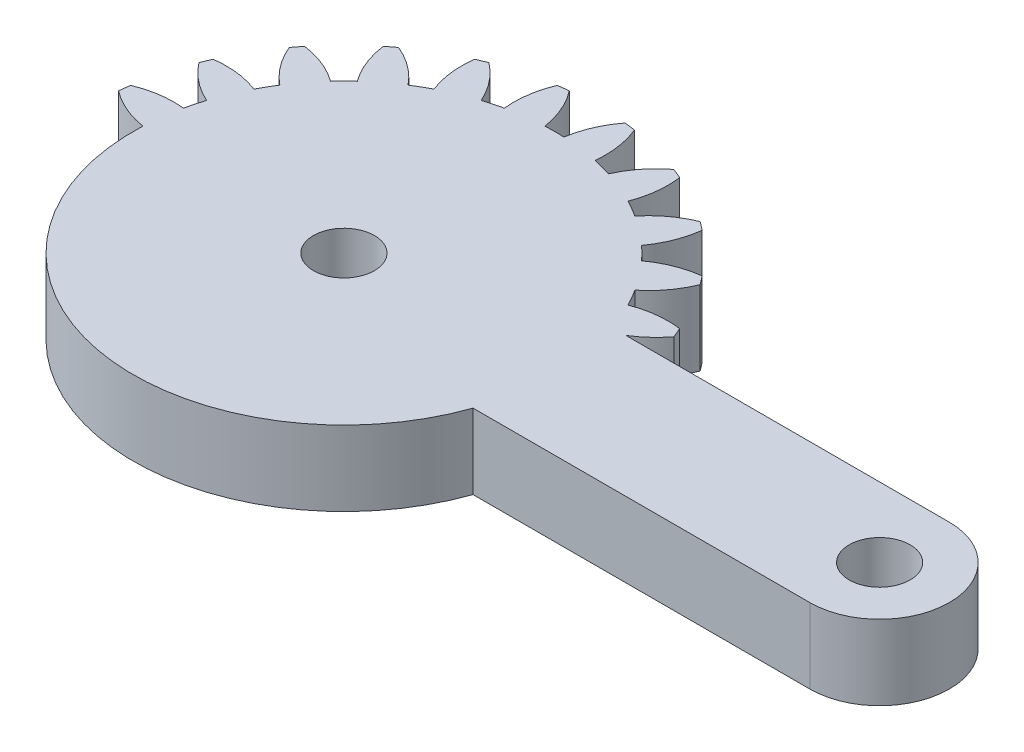
from build123d import *
from build123d.topology import SkipClean

# Parameters (mm, degrees)
SKETCH1_R           = 1.75
BOSS_EXTRUDE1_DEPTH = 4.3
CUT_EXTRUDE1_START  = -10
CUT_EXTRUDE1_DEPTH  = 10


with BuildPart() as part:
    # Sketch1 → Boss-Extrude1 (new body)
    with BuildSketch(Plane(origin=(0, 0, 0), x_dir=(1, 0, 0), z_dir=(0, 1, 0))):
        with BuildLine():
            Line((20.643657446, 4), (2.081641936, 4))
            ThreePointArc((2.081641936, 4), (2.861028333, 4.588201733), (3.521749436, 5.30713988))
            ThreePointArc((3.521749436, 5.30713988), (3.405395609, 5.596745198), (3.282888305, 5.883801663))
            ThreePointArc((3.282888305, 5.883801663), (1.93527598, 5.894040025), (0.627094961, 5.57027124))
            ThreePointArc((0.627094961, 5.57027124), (0.366286148, 6.046375), (0.084372603, 6.510293938))
            ThreePointArc((0.084372603, 6.510293938), (1.018855105, 7.48132754), (1.683794586, 8.65351323))
            ThreePointArc((1.683794586, 8.65351323), (1.496450048, 8.903135899), (1.303821399, 9.148703928))
            ThreePointArc((1.303821399, 9.148703928), (-0.000522033, 8.809805691), (-1.180330337, 8.158486898))
            ThreePointArc((-1.180330337, 8.158486898), (-1.555477026, 8.550865528), (-1.947855656, 8.926012217))
            ThreePointArc((-1.947855656, 8.926012217), (-1.296536862, 10.105820521), (-0.957638625, 11.410163953))
            ThreePointArc((-0.957638625, 11.410163953), (-1.203206655, 11.602792602), (-1.452829324, 11.79013714))
            ThreePointArc((-1.452829324, 11.79013714), (-2.625015014, 11.125197659), (-3.596048616, 10.190715157))
            ThreePointArc((-3.596048616, 10.190715157), (-4.059967554, 10.472628702), (-4.536071314, 10.733437515))
            ThreePointArc((-4.536071314, 10.733437515), (-4.212302529, 12.041618533), (-4.222540891, 13.389230859))
            ThreePointArc((-4.222540891, 13.389230859), (-4.509597355, 13.511738163), (-4.799202674, 13.62809199))
            ThreePointArc((-4.799202674, 13.62809199), (-5.759348103, 12.682425791), (-6.455432668, 11.528463019))
            ThreePointArc((-6.455432668, 11.528463019), (-6.976508546, 11.680699536), (-7.503891752, 11.809396783))
            ThreePointArc((-7.503891752, 11.809396783), (-7.529737283, 13.156800143), (-7.888414517, 14.455843809))
            ThreePointArc((-7.888414517, 14.455843809), (-8.197396993, 14.499881098), (-8.507248835, 14.537314892))
            ThreePointArc((-8.507248835, 14.537314892), (-9.18992168, 13.375367565), (-9.563620196, 12.080565177))
            ThreePointArc((-9.563620196, 12.080565177), (-10.106342554, 12.09275), (-10.649064912, 12.080565177))
            ThreePointArc((-10.649064912, 12.080565177), (-11.022763428, 13.375367565), (-11.705436272, 14.537314892))
            ThreePointArc((-11.705436272, 14.537314892), (-12.015288115, 14.499881098), (-12.324270591, 14.455843809))
            ThreePointArc((-12.324270591, 14.455843809), (-12.682947825, 13.156800143), (-12.708793355, 11.809396783))
            ThreePointArc((-12.708793355, 11.809396783), (-13.236176561, 11.680699536), (-13.757252439, 11.528463019))
            ThreePointArc((-13.757252439, 11.528463019), (-14.453337005, 12.682425791), (-15.413482434, 13.62809199))
            ThreePointArc((-15.413482434, 13.62809199), (-15.703087752, 13.511738163), (-15.990144217, 13.389230859))
            ThreePointArc((-15.990144217, 13.389230859), (-16.000382579, 12.041618533), (-15.676613793, 10.733437515))
            ThreePointArc((-15.676613793, 10.733437515), (-16.152717554, 10.472628702), (-16.616636492, 10.190715157))
            ThreePointArc((-16.616636492, 10.190715157), (-17.587670094, 11.125197659), (-18.759855783, 11.79013714))
            ThreePointArc((-18.759855783, 11.79013714), (-19.009478453, 11.602792602), (-19.255046482, 11.410163953))
            ThreePointArc((-19.255046482, 11.410163953), (-18.916148245, 10.105820521), (-18.264829452, 8.926012217))
            ThreePointArc((-18.264829452, 8.926012217), (-18.657208082, 8.550865528), (-19.032354771, 8.158486898))
            ThreePointArc((-19.032354771, 8.158486898), (-20.212163074, 8.809805691), (-21.516506507, 9.148703928))
            ThreePointArc((-21.516506507, 9.148703928), (-21.709135156, 8.903135899), (-21.896479694, 8.65351323))
            ThreePointArc((-21.896479694, 8.65351323), (-21.231540213, 7.48132754), (-20.297057711, 6.510293938))
            ThreePointArc((-20.297057711, 6.510293938), (-20.578971255, 6.046375), (-20.839780068, 5.57027124))
            ThreePointArc((-20.839780068, 5.57027124), (-22.147961087, 5.894040025), (-23.495573413, 5.883801663))
            ThreePointArc((-23.495573413, 5.883801663), (-23.618080717, 5.596745198), (-23.734434544, 5.30713988))
            ThreePointArc((-23.734434544, 5.30713988), (-22.788768345, 4.346994451), (-21.634805572, 3.650909885))
            ThreePointArc((-21.634805572, 3.650909885), (-21.78704209, 3.129834008), (-21.915739337, 2.602450802))
            ThreePointArc((-21.915739337, 2.602450802), (-23.263142697, 2.576605271), (-24.562186363, 2.217928037))
            ThreePointArc((-24.562186363, 2.217928037), (-24.606223651, 1.908945561), (-24.643657446, 1.599093719))
            ThreePointArc((-24.643657446, 1.599093719), (-23.481710119, 0.916420874), (-22.186907731, 0.542722358))
            ThreePointArc((-22.186907731, 0.542722358), (-22.199092554, 0), (-22.186907731, -0.542722358))
            ThreePointArc((-22.186907731, -0.542722358), (-23.481710119, -0.916420874), (-24.643657446, -1.599093719))
            ThreePointArc((-24.643657446, -1.599093719), (-24.606223651, -1.908945561), (-24.562186363, -2.217928037))
            ThreePointArc((-24.562186363, -2.217928037), (-23.263142697, -2.576605271), (-21.915739337, -2.602450802))
            ThreePointArc((-21.915739337, -2.602450802), (-21.78704209, -3.129834008), (-21.634805572, -3.650909885))
            ThreePointArc((-21.634805572, -3.650909885), (-22.788768345, -4.346994451), (-23.734434544, -5.30713988))
            ThreePointArc((-23.734434544, -5.30713988), (-23.618080717, -5.596745198), (-23.495573413, -5.883801663))
            ThreePointArc((-23.495573413, -5.883801663), (-22.147961087, -5.894040025), (-20.839780068, -5.57027124))
            ThreePointArc((-20.839780068, -5.57027124), (-20.578971255, -6.046375), (-20.297057711, -6.510293938))
            ThreePointArc((-20.297057711, -6.510293938), (-21.231540213, -7.48132754), (-21.896479694, -8.65351323))
            ThreePointArc((-21.896479694, -8.65351323), (-21.709135156, -8.903135899), (-21.516506507, -9.148703928))
            ThreePointArc((-21.516506507, -9.148703928), (-20.212163074, -8.809805691), (-19.032354771, -8.158486898))
            ThreePointArc((-19.032354771, -8.158486898), (-18.657208082, -8.550865528), (-18.264829452, -8.926012217))
            ThreePointArc((-18.264829452, -8.926012217), (-18.916148245, -10.105820521), (-19.255046482, -11.410163953))
            ThreePointArc((-19.255046482, -11.410163953), (-19.009478453, -11.602792602), (-18.759855783, -11.79013714))
            ThreePointArc((-18.759855783, -11.79013714), (-17.587670094, -11.125197659), (-16.616636492, -10.190715157))
            ThreePointArc((-16.616636492, -10.190715157), (-16.152717554, -10.472628702), (-15.676613793, -10.733437515))
            ThreePointArc((-15.676613793, -10.733437515), (-16.000382579, -12.041618533), (-15.990144217, -13.389230859))
            ThreePointArc((-15.990144217, -13.389230859), (-15.703087752, -13.511738163), (-15.413482434, -13.62809199))
            ThreePointArc((-15.413482434, -13.62809199), (-14.453337005, -12.682425791), (-13.757252439, -11.528463019))
            ThreePointArc((-13.757252439, -11.528463019), (-13.236176561, -11.680699536), (-12.708793355, -11.809396783))
            ThreePointArc((-12.708793355, -11.809396783), (-12.682947825, -13.156800143), (-12.324270591, -14.455843809))
            ThreePointArc((-12.324270591, -14.455843809), (-12.015288115, -14.499881098), (-11.705436272, -14.537314892))
            ThreePointArc((-11.705436272, -14.537314892), (-11.022763428, -13.375367565), (-10.649064912, -12.080565177))
            ThreePointArc((-10.649064912, -12.080565177), (-10.106342554, -12.09275), (-9.563620196, -12.080565177))
            ThreePointArc((-9.563620196, -12.080565177), (-9.18992168, -13.375367565), (-8.507248835, -14.537314892))
            ThreePointArc((-8.507248835, -14.537314892), (-8.197396993, -14.499881098), (-7.888414517, -14.455843809))
            ThreePointArc((-7.888414517, -14.455843809), (-7.529737283, -13.156800143), (-7.503891752, -11.809396783))
            ThreePointArc((-7.503891752, -11.809396783), (-6.976508546, -11.680699536), (-6.455432668, -11.528463019))
            ThreePointArc((-6.455432668, -11.528463019), (-5.759348103, -12.682425791), (-4.799202674, -13.62809199))
            ThreePointArc((-4.799202674, -13.62809199), (-4.509597355, -13.511738163), (-4.222540891, -13.389230859))
            ThreePointArc((-4.222540891, -13.389230859), (-4.212302529, -12.041618533), (-4.536071314, -10.733437515))
            ThreePointArc((-4.536071314, -10.733437515), (-4.059967554, -10.472628702), (-3.596048616, -10.190715157))
            ThreePointArc((-3.596048616, -10.190715157), (-2.625015014, -11.125197659), (-1.452829324, -11.79013714))
            ThreePointArc((-1.452829324, -11.79013714), (-1.203206655, -11.602792602), (-0.957638625, -11.410163953))
            ThreePointArc((-0.957638625, -11.410163953), (-1.296536862, -10.105820521), (-1.947855656, -8.926012217))
            ThreePointArc((-1.947855656, -8.926012217), (-1.555477026, -8.550865528), (-1.180330337, -8.158486898))
            ThreePointArc((-1.180330337, -8.158486898), (-0.000522033, -8.809805691), (1.303821399, -9.148703928))
            ThreePointArc((1.303821399, -9.148703928), (1.496450048, -8.903135899), (1.683794586, -8.65351323))
            ThreePointArc((1.683794586, -8.65351323), (1.018855105, -7.48132754), (0.084372603, -6.510293938))
            ThreePointArc((0.084372603, -6.510293938), (0.366286148, -6.046375), (0.627094961, -5.57027124))
            ThreePointArc((0.627094961, -5.57027124), (1.93527598, -5.894040025), (3.282888305, -5.883801663))
            ThreePointArc((3.282888305, -5.883801663), (3.405395609, -5.596745198), (3.521749436, -5.30713988))
            ThreePointArc((3.521749436, -5.30713988), (2.861028333, -4.588201733), (2.081641936, -4))
            Line((2.081641936, -4), (20.643657446, -4))
            ThreePointArc((20.643657446, -4), (24.643657446, 0), (20.643657446, 4))
        make_face()
        with Locations(Location((-10.106342554, 0, 0), (0, 0, 90))):
            Circle(SKETCH1_R, mode=Mode.SUBTRACT)
        with Locations(Location((20.643657446, 0, 0), (0, 0, 90))):
            Circle(SKETCH1_R, mode=Mode.SUBTRACT)
    extrude(amount=BOSS_EXTRUDE1_DEPTH)

    # Sketch2 → Cut-Extrude1 (cut)
    with SkipClean():  # the faces are left unmerged after this step: merging them gives an invalid solid
        with BuildSketch(Plane(origin=(0, 4.3, 0), x_dir=(1, 0, 0), z_dir=(0, 1, 0)).offset(CUT_EXTRUDE1_START)):
            with BuildLine():
                ThreePointArc((-24.562186363, -2.217928037), (-23.263142697, -2.576605271), (-21.915739337, -2.602450802))
                ThreePointArc((-21.915739337, -2.602450802), (-22.095637401, -1.578420611), (-22.186907731, -0.542722358))
                ThreePointArc((-22.186907731, -0.542722358), (-23.481710119, -0.916420874), (-24.643657446, -1.599093719))
                ThreePointArc((-24.643657446, -1.599093719), (-24.606223651, -1.908945561), (-24.562186363, -2.217928037))
            make_face()
            with BuildLine():
                ThreePointArc((-23.495573413, -5.883801663), (-22.147961087, -5.894040025), (-20.839780068, -5.57027124))
                ThreePointArc((-20.839780068, -5.57027124), (-21.278586771, -4.627695077), (-21.634805572, -3.650909885))
                ThreePointArc((-21.634805572, -3.650909885), (-22.788768345, -4.346994451), (-23.734434544, -5.30713988))
                ThreePointArc((-23.734434544, -5.30713988), (-23.618080717, -5.596745198), (-23.495573413, -5.883801663))
            make_face()
            with BuildLine():
                ThreePointArc((-21.516506507, -9.148703928), (-20.212163074, -8.809805691), (-19.032354771, -8.158486898))
                ThreePointArc((-19.032354771, -8.158486898), (-19.70016616, -7.361599771), (-20.297057711, -6.510293938))
                ThreePointArc((-20.297057711, -6.510293938), (-21.231540213, -7.48132754), (-21.896479694, -8.65351323))
                ThreePointArc((-21.896479694, -8.65351323), (-21.709135156, -8.903135899), (-21.516506507, -9.148703928))
            make_face()
            with BuildLine():
                ThreePointArc((-18.759855783, -11.79013714), (-17.587670094, -11.125197659), (-16.616636492, -10.190715157))
                ThreePointArc((-16.616636492, -10.190715157), (-17.467942324, -9.593823606), (-18.264829452, -8.926012217))
                ThreePointArc((-18.264829452, -8.926012217), (-18.916148245, -10.105820521), (-19.255046482, -11.410163953))
                ThreePointArc((-19.255046482, -11.410163953), (-19.009478453, -11.602792602), (-18.759855783, -11.79013714))
            make_face()
            with BuildLine():
                ThreePointArc((-15.413482434, -13.62809199), (-14.453337005, -12.682425791), (-13.757252439, -11.528463019))
                ThreePointArc((-13.757252439, -11.528463019), (-14.734037631, -11.172244217), (-15.676613793, -10.733437515))
                ThreePointArc((-15.676613793, -10.733437515), (-16.000382579, -12.041618533), (-15.990144217, -13.389230859))
                ThreePointArc((-15.990144217, -13.389230859), (-15.703087752, -13.511738163), (-15.413482434, -13.62809199))
            make_face()
            with BuildLine():
                ThreePointArc((-11.705436272, -14.537314892), (-11.022763428, -13.375367565), (-10.649064912, -12.080565177))
                ThreePointArc((-10.649064912, -12.080565177), (-11.684763165, -11.989294847), (-12.708793355, -11.809396783))
                ThreePointArc((-12.708793355, -11.809396783), (-12.682947825, -13.156800143), (-12.324270591, -14.455843809))
                ThreePointArc((-12.324270591, -14.455843809), (-12.015288115, -14.499881098), (-11.705436272, -14.537314892))
            make_face()
            with BuildLine():
                ThreePointArc((-7.888414517, -14.455843809), (-7.529737283, -13.156800143), (-7.503891752, -11.809396783))
                ThreePointArc((-7.503891752, -11.809396783), (-8.527921943, -11.989294847), (-9.563620196, -12.080565177))
                ThreePointArc((-9.563620196, -12.080565177), (-9.18992168, -13.375367565), (-8.507248835, -14.537314892))
                ThreePointArc((-8.507248835, -14.537314892), (-8.197396993, -14.499881098), (-7.888414517, -14.455843809))
            make_face()
            with BuildLine():
                ThreePointArc((-4.222540891, -13.389230859), (-4.212302529, -12.041618533), (-4.536071314, -10.733437515))
                ThreePointArc((-4.536071314, -10.733437515), (-5.478647477, -11.172244217), (-6.455432668, -11.528463019))
                ThreePointArc((-6.455432668, -11.528463019), (-5.759348103, -12.682425791), (-4.799202674, -13.62809199))
                ThreePointArc((-4.799202674, -13.62809199), (-4.509597355, -13.511738163), (-4.222540891, -13.389230859))
            make_face()
            with BuildLine():
                ThreePointArc((-0.957638625, -11.410163953), (-1.296536862, -10.105820521), (-1.947855656, -8.926012217))
                ThreePointArc((-1.947855656, -8.926012217), (-2.744742783, -9.593823606), (-3.596048616, -10.190715157))
                ThreePointArc((-3.596048616, -10.190715157), (-2.625015014, -11.125197659), (-1.452829324, -11.79013714))
                ThreePointArc((-1.452829324, -11.79013714), (-1.203206655, -11.602792602), (-0.957638625, -11.410163953))
            make_face()
            with BuildLine():
                ThreePointArc((1.683794586, -8.65351323), (1.018855105, -7.48132754), (0.084372603, -6.510293938))
                ThreePointArc((0.084372603, -6.510293938), (-0.512518948, -7.361599771), (-1.180330337, -8.158486898))
                ThreePointArc((-1.180330337, -8.158486898), (-0.000522033, -8.809805691), (1.303821399, -9.148703928))
                ThreePointArc((1.303821399, -9.148703928), (1.496450048, -8.903135899), (1.683794586, -8.65351323))
            make_face()
            with BuildLine():
                ThreePointArc((3.521749436, -5.30713988), (2.861028333, -4.588201733), (2.081641936, -4))
                Line((2.081641936, -4), (1.305695063, -4))
                ThreePointArc((1.305695063, -4), (0.994195953, -4.797149927), (0.627094961, -5.57027124))
                ThreePointArc((0.627094961, -5.57027124), (1.93527598, -5.894040025), (3.282888305, -5.883801663))
                ThreePointArc((3.282888305, -5.883801663), (3.405395609, -5.596745198), (3.521749436, -5.30713988))
            make_face()
        extrude(amount=CUT_EXTRUDE1_DEPTH, mode=Mode.SUBTRACT)


solid = part.part
